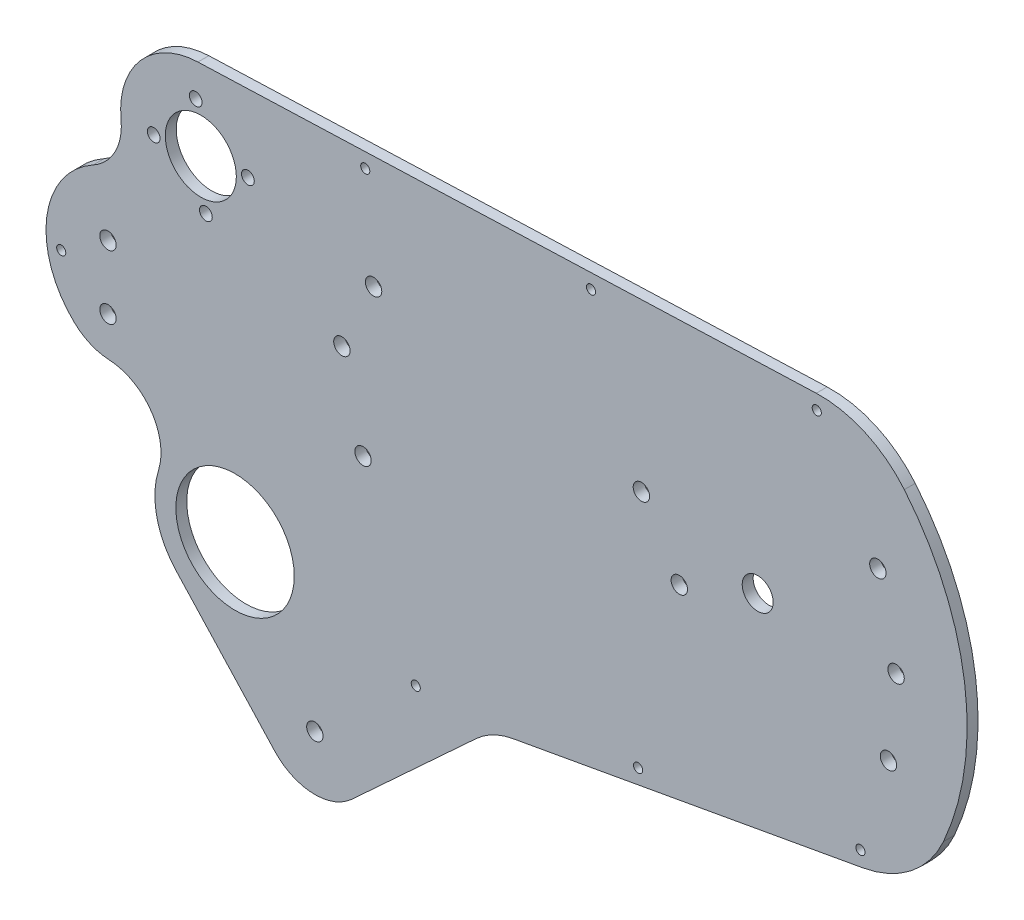
from build123d import *

# Parameters (mm, degrees)
SKETCH1_R           = 2.25
SKETCH1_R_2         = 16.25
SKETCH1_R_3         = 4.25
SKETCH1_R_4         = 1.75
SKETCH1_R_5         = 9.75
BOSS_EXTRUDE1_DEPTH = 3
SKETCH2_R           = 1.25
CUT_EXTRUDE1_DEPTH  = 190.515777006


with BuildPart() as part:
    # Sketch1 → Boss-Extrude1 (new body)
    with BuildSketch(Plane.XY):
        with BuildLine():
            ThreePointArc((-137.970351553, -33.480224156), (-126.431132561, -39.888203569), (-124.422839539, -52.93360637))
            ThreePointArc((-124.422839539, -52.93360637), (-124.888175134, -64.31939994), (-119.594822483, -74.410646153))
            Line((-119.594822483, -74.410646153), (-92.540517723, -103.740413224))
            ThreePointArc((-92.540517723, -103.740413224), (-82.119700521, -108.557935129), (-71.344567605, -104.595807028))
            Line((-71.344567605, -104.595807028), (-37.221129556, -73.119733925))
            ThreePointArc((-37.221129556, -73.119733925), (-32.538343047, -69.892896145), (-27.140055215, -68.104192696))
            Line((-27.140055215, -68.104192696), (68.925058584, -50.795851294))
            ThreePointArc((68.925058584, -50.795851294), (82.107908339, -44.886103489), (91, -33.5))
            ThreePointArc((91, -33.5), (96.805715124, 7.17766304), (80.26119478, 44.789595257))
            ThreePointArc((80.26119478, 44.789595257), (69.434281248, 53.01522195), (56.08825014, 55.616461034))
            Line((56.08825014, 55.616461034), (-113.612398701, 49.485657112))
            ThreePointArc((-113.612398701, 49.485657112), (-129.404310002, 41.953312576), (-134.705774542, 25.279526249))
            ThreePointArc((-134.705774542, 25.279526249), (-136.343375771, 16.802270376), (-142.382746132, 10.632050724))
            ThreePointArc((-142.382746132, 10.632050724), (-155.099864059, -8.058287742), (-147.542861296, -29.364285714))
            ThreePointArc((-147.542861296, -29.364285714), (-143.125485566, -32.280163581), (-137.970351553, -33.480224156))
        make_face()
        with Locations((-81.514845762, -93.570135067)):
            Circle(SKETCH1_R, mode=Mode.SUBTRACT)
        with Locations((-103.42383694, -59.494238188)):
            Circle(SKETCH1_R_2, mode=Mode.SUBTRACT)
        with Locations((-138.3, -22.75)):
            Circle(SKETCH1_R, mode=Mode.SUBTRACT)
        with Locations((-138.3, -5.25)):
            Circle(SKETCH1_R, mode=Mode.SUBTRACT)
        with Locations((-68.3, -21.5)):
            Circle(SKETCH1_R, mode=Mode.SUBTRACT)
        with Locations((-74.1, 1.7)):
            Circle(SKETCH1_R, mode=Mode.SUBTRACT)
        with Locations((-65.4, 20.2)):
            Circle(SKETCH1_R, mode=Mode.SUBTRACT)
        with Locations((18.5, -8.7)):
            Circle(SKETCH1_R, mode=Mode.SUBTRACT)
        with Locations((8.1, 8.2)):
            Circle(SKETCH1_R, mode=Mode.SUBTRACT)
        with Locations((75.9, -21.8)):
            Circle(SKETCH1_R, mode=Mode.SUBTRACT)
        with Locations((40.017782272, 0)):
            Circle(SKETCH1_R_3, mode=Mode.SUBTRACT)
        with Locations((78, -0.1)):
            Circle(SKETCH1_R, mode=Mode.SUBTRACT)
        with Locations((73, 22.4)):
            Circle(SKETCH1_R, mode=Mode.SUBTRACT)
        with Locations((-114.213840088, 40.424858245)):
            Circle(SKETCH1_R_4, mode=Mode.SUBTRACT)
        with Locations((-111.422396488, 14.575141755)):
            Circle(SKETCH1_R_4, mode=Mode.SUBTRACT)
        with Locations((-125.742976533, 26.1042782)):
            Circle(SKETCH1_R_4, mode=Mode.SUBTRACT)
        with Locations((-112.818118288, 27.5)):
            Circle(SKETCH1_R_5, mode=Mode.SUBTRACT)
        with Locations((-99.893260043, 28.8957218)):
            Circle(SKETCH1_R_4, mode=Mode.SUBTRACT)
    extrude(amount=BOSS_EXTRUDE1_DEPTH)

    # Sketch2 → Cut-Extrude1 (cut, through all)
    with BuildSketch(Plane.XY.offset(3)):
        with Locations((56.232664601, 51.619068826)):
            Circle(SKETCH2_R)
        with Locations((-5.72691462, 49.380644672)):
            Circle(SKETCH2_R)
        with Locations((-67.686493842, 47.142220518)):
            Circle(SKETCH2_R)
        with Locations((68.215786874, -46.859236804)):
            Circle(SKETCH2_R)
        with Locations((7.198262283, -57.852948313)):
            Circle(SKETCH2_R)
        with Locations((-151.125466228, -14)):
            Circle(SKETCH2_R)
        with Locations((-53.819262309, -68.846659822)):
            Circle(SKETCH2_R)
    extrude(amount=-CUT_EXTRUDE1_DEPTH, mode=Mode.SUBTRACT)


solid = part.part
